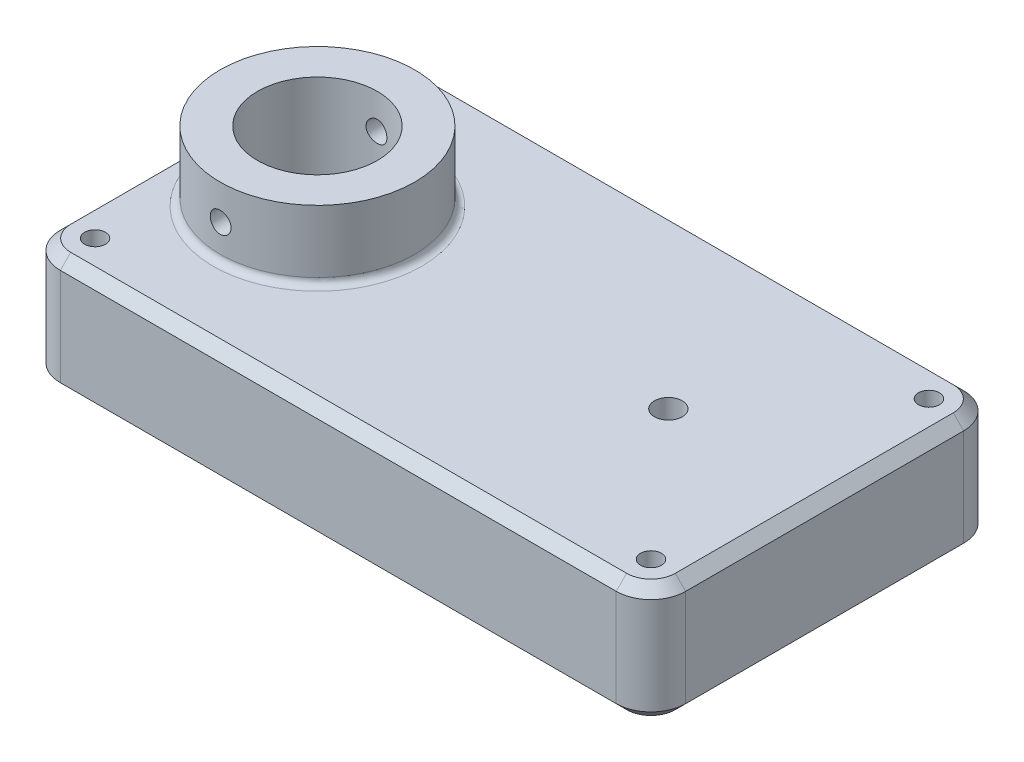
from build123d import *

# Parameters (mm, degrees)
SKETCH1_W                = 180
SKETCH1_H                = 34
BOSS_EXTRUDE1_DEPTH      = 50
FILLET1_R                = 10
CHAMFER1_SIZE            = 3
SKETCH2_R                = 28
BOSS_EXTRUDE2_DEPTH      = 20
SKETCH3_R                = 17.25
CUT_EXTRUDE1_DEPTH       = 117.258333035
SKETCH4_R                = 4
CUT_EXTRUDE2_DEPTH       = 109.425089347
FILLET2_R                = 2
F_6_0_6_DIAMETER_HOLE1_D = 6
CUT_EXTRUDE3_DEPTH       = 110.402925007
CUT_EXTRUDE3_DEPTH_BACK  = 110.402925007
SKETCH8_R                = 3


with BuildPart() as part:
    # Sketch1 → Boss-Extrude1 (new, symmetric)
    with BuildSketch(Plane.XY):
        Rectangle(SKETCH1_W, SKETCH1_H)
    extrude(amount=BOSS_EXTRUDE1_DEPTH, both=True)

    # Fillet1
    fillet1_edges = [part.edges().sort_by_distance(p)[0] for p in [
        (90, 0, 50),
        (-90, 0, 50),
        (90, 0, -50),
        (-90, 0, -50),
    ]]
    fillet(fillet1_edges, radius=FILLET1_R)

    # Chamfer1
    chamfer1_edges = [part.edges().sort_by_distance(p)[0] for p in [
        (0, -17, 50),
        (0, 17, 50),
        (0, -17, -50),
        (90, -17, 0),
        (-90, -17, 0),
        (87.071067812, -17, 47.071067812),
        (87.071067812, -17, -47.071067812),
        (-87.071067812, -17, -47.071067812),
        (-87.071067812, -17, 47.071067812),
        (-90, 17, 0),
        (0, 17, -50),
        (90, 17, 0),
        (87.071067812, 17, 47.071067812),
        (87.071067812, 17, -47.071067812),
        (-87.071067812, 17, -47.071067812),
        (-87.071067812, 17, 47.071067812),
    ]]
    chamfer(chamfer1_edges, length=CHAMFER1_SIZE)

    # Sketch2 → Boss-Extrude2 (add)
    with BuildSketch(Plane(origin=(0, 17, 0), x_dir=(1, 0, 0), z_dir=(0, 1, 0))):
        with Locations((-56, 0)):
            Circle(SKETCH2_R)
    extrude(amount=BOSS_EXTRUDE2_DEPTH)

    # Sketch3 → Cut-Extrude1 (cut, through all)
    with BuildSketch(Plane(origin=(0, 37, 0), x_dir=(1, 0, 0), z_dir=(0, 1, 0))):
        with Locations(Location((-56, 0, 0), (0, 0, 180))):
            Circle(SKETCH3_R)
    extrude(amount=-CUT_EXTRUDE1_DEPTH, mode=Mode.SUBTRACT)

    # Sketch4 → Cut-Extrude2 (cut, through all)
    with BuildSketch(Plane(origin=(0, 17, 0), x_dir=(1, 0, 0), z_dir=(0, 1, 0))):
        with Locations(Location((45, 0, 0), (0, 0, 180))):
            Circle(SKETCH4_R)
    extrude(amount=-CUT_EXTRUDE2_DEPTH, mode=Mode.SUBTRACT)

    # Fillet2
    fillet2_edges = [part.edges().sort_by_distance(p)[0] for p in [
        (-84, 17, 0),
    ]]
    fillet(fillet2_edges, radius=FILLET2_R)

    # Ø6.0 (6) Diameter Hole1 (through all)
    with Locations(Plane(origin=(0, 17, 0), x_dir=(1, 0, 0), z_dir=(0, 1, 0))):
        with Locations((80, -40), (-80, -40), (80, 40), (-80, 40)):
            Hole(F_6_0_6_DIAMETER_HOLE1_D / 2)

    # Sketch8 → Cut-Extrude3 (cut, two sides: drawn at the far end of the back side and taken through both)
    with BuildSketch(Plane.XY.offset(-CUT_EXTRUDE3_DEPTH_BACK)):
        with Locations((-56, 27)):
            Circle(SKETCH8_R)
    extrude(amount=CUT_EXTRUDE3_DEPTH + CUT_EXTRUDE3_DEPTH_BACK, mode=Mode.SUBTRACT)


solid = part.part
